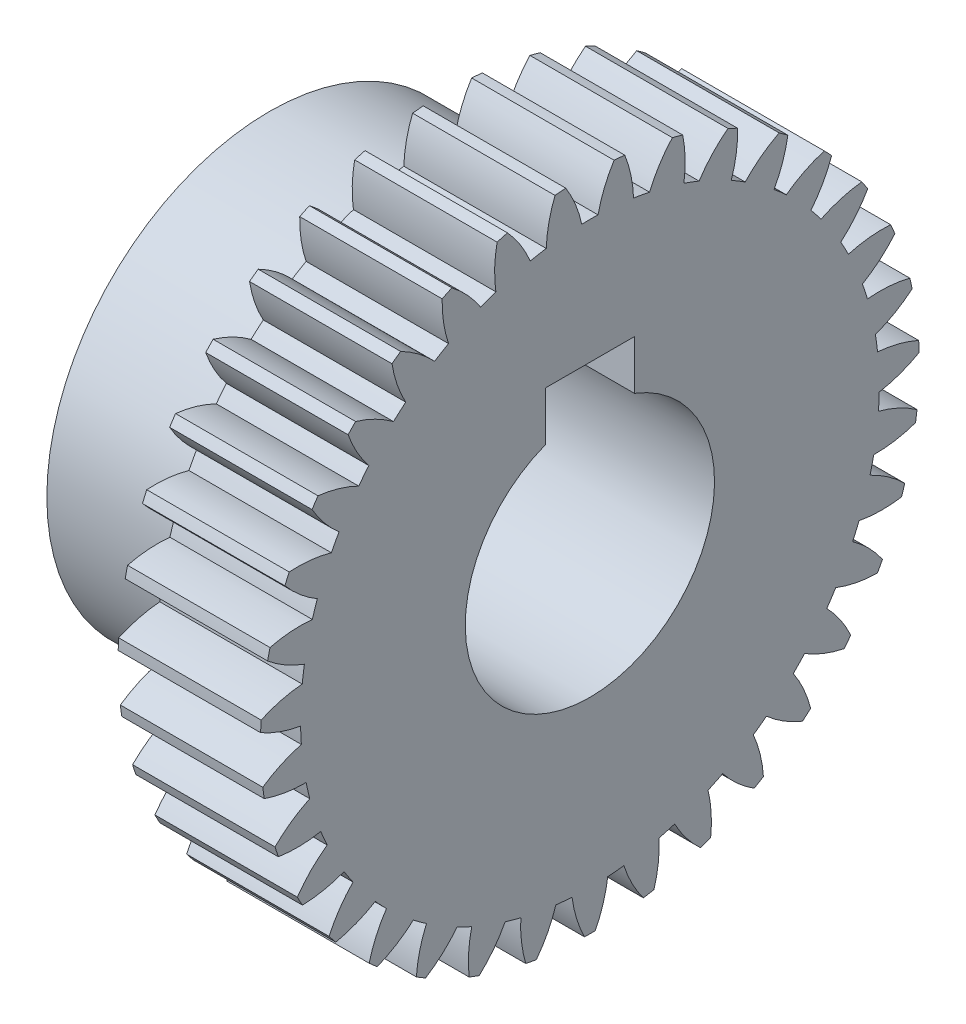
from build123d import *

# Parameters (mm, degrees)
BASPROSKE_W      = 8
BASPROSKE_H      = 18.5
TOOTHCUT_DEPTH   = 28.358728041
TEETHCUTS_COUNT  = 35
TEETHCUTS_ANGLE  = 349.714285714
HUBNEAONESKE_R   = 12.5
HUBNEARONE_DEPTH = 10.0000508
BORSKE_R         = 7
BORE_DEPTH       = 18.0000508
KEYSKE_W         = 5
KEYSKE_H         = 9.3
KEYWAY_DEPTH     = 18.0000508


with BuildPart() as part:
    # BasProSke → Base-Revolve (revolve)
    with BuildSketch(Plane(origin=(0, 0, 0), x_dir=(1, 0, 0), z_dir=(0, 1, 0)), mode=Mode.PRIVATE) as base_revolve_sk:
        with Locations((4, 9.25)):
            Rectangle(BASPROSKE_W, BASPROSKE_H)
    revolve(base_revolve_sk.sketch.rotate(Axis((-10, 0, 0), (1, 0, 0)), 180), axis=Axis((-10, 0, 0), (1, 0, 0)))

    # TooCutSke → ToothCut (cut, through all)
    with BuildSketch(Plane(origin=(0, 0, 0), x_dir=(0, 0, -1), z_dir=(1, 0, 0))):
        with BuildLine():
            ThreePointArc((0.456361119, 16.242590173), (0, 16.249), (-0.456361119, 16.242590173))
            ThreePointArc((-0.456361119, 16.242590173), (-0.817781123, 17.39831105), (-1.372969849, 18.474452602))
            ThreePointArc((-1.372969849, 18.474452602), (0, 18.5254), (1.372969849, 18.474452602))
            ThreePointArc((1.372969849, 18.474452602), (0.817781123, 17.39831105), (0.456361119, 16.242590173))
        make_face()
    toothcut = extrude(amount=TOOTHCUT_DEPTH, mode=Mode.SUBTRACT)

    # TeethCuts: ToothCut ×35 about axis
    teethcuts_axis = Axis((-10, 0, 0), (1, 0, 0))
    for i in range(1, TEETHCUTS_COUNT):
        add(toothcut.rotate(teethcuts_axis, i * TEETHCUTS_ANGLE / (TEETHCUTS_COUNT - 1)), mode=Mode.SUBTRACT)

    # HubNeaOneSke → HubNearOne (add)
    with BuildSketch(Plane.ZY):
        with Locations(Location((0, 0, 0), (0, 0, 180))):
            Circle(HUBNEAONESKE_R)
    extrude(amount=HUBNEARONE_DEPTH)

    # BorSke → Bore (cut, symmetric)
    with BuildSketch(Plane(origin=(0, 0, 0), x_dir=(0, 0, -1), z_dir=(1, 0, 0))):
        with Locations(Location((0, 0, 0), (0, 0, 180))):
            Circle(BORSKE_R)
    extrude(amount=BORE_DEPTH, both=True, mode=Mode.SUBTRACT)

    # KeySke → Keyway (cut, symmetric)
    with BuildSketch(Plane(origin=(0, 0, 0), x_dir=(0, 0, -1), z_dir=(1, 0, 0))):
        with Locations((0, 4.65)):
            Rectangle(KEYSKE_W, KEYSKE_H)
    extrude(amount=KEYWAY_DEPTH, both=True, mode=Mode.SUBTRACT)


solid = part.part
